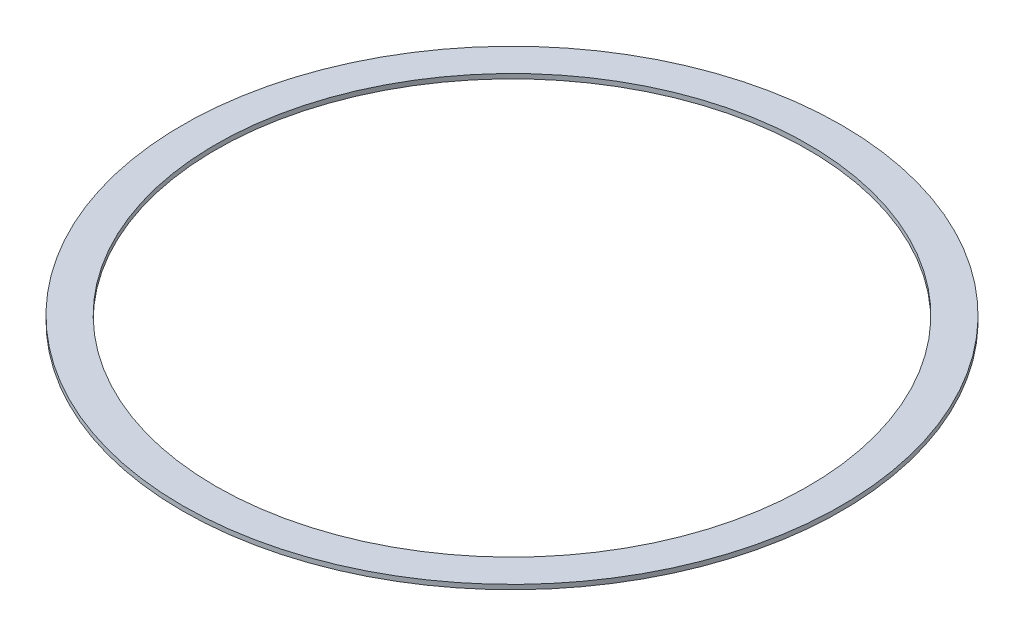
from build123d import *

# Parameters (mm, degrees)
SKETCH1_R           = 180.5559
SKETCH1_R_2         = 162.2679
BOSS_EXTRUDE1_DEPTH = 2.54


with BuildPart() as part:
    # Sketch1 → Boss-Extrude1 (new body)
    with BuildSketch(Plane(origin=(0, 0, 0), x_dir=(1, 0, 0), z_dir=(0, 1, 0))):
        with Locations(Location((0, 0, 0), (0, 0, 270))):
            Circle(SKETCH1_R)
        with Locations(Location((0, 0, 0), (0, 0, 270))):
            Circle(SKETCH1_R_2, mode=Mode.SUBTRACT)
    extrude(amount=BOSS_EXTRUDE1_DEPTH)


solid = part.part
